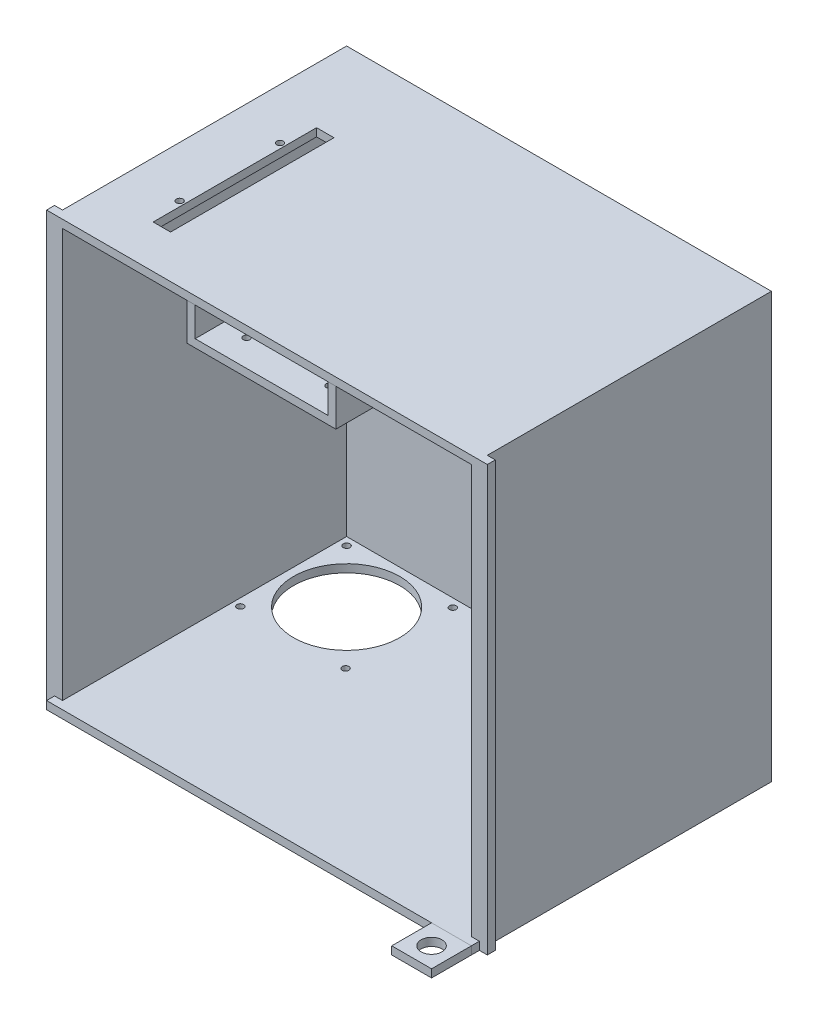
from build123d import *

# Parameters (mm, degrees)
SKETCH1_W              = 203.2
SKETCH1_H              = 203.2
OUTTER_BOX_DEPTH       = 139.7
SHELL1_T               = -3.81
SKETCH4_W              = 71.12
SKETCH4_H              = 63.5
RFID_CARD_HOLDER_DEPTH = 17.78
SHELL2_T               = -3.81
SKETCH6_W              = 203.2
SKETCH6_H              = 3.81
BOSS_EXTRUDE4_DEPTH    = 3.81
SKETCH12_W             = 8.3185
SKETCH12_H             = 78.1685
CUT_EXTRUDE7_DEPTH     = 3.81
SKETCH13_W             = 3.81
SKETCH13_H             = 203.2
BOSS_EXTRUDE5_DEPTH    = 3.81
SKETCH14_W             = 3.81
SKETCH14_H             = 203.2
BOSS_EXTRUDE6_DEPTH    = 3.81
SKETCH16_W             = 19.05
SKETCH16_H             = 3.81
BOSS_EXTRUDE7_DEPTH    = 19.05
SKETCH18_R             = 5
CUT_EXTRUDE9_DEPTH     = 3.81
SKETCH5_R              = 25.4
CUT_EXTRUDE10_DEPTH    = 3.81
SKETCH19_R             = 1.6
CUT_EXTRUDE11_DEPTH    = 3.81
SKETCH20_R             = 1.6
CUT_EXTRUDE12_DEPTH    = 3.81
SKETCH21_W             = 3.81
SKETCH21_H             = 195.58
BOSS_EXTRUDE9_DEPTH    = 12.7
SKETCH23_R             = 1.5875
CUT_EXTRUDE13_DEPTH    = 3.81


with BuildPart() as part:
    # Sketch1 → Outter Box (new body)
    with BuildSketch(Plane.XY):
        Rectangle(SKETCH1_W, SKETCH1_H)
    extrude(amount=OUTTER_BOX_DEPTH)

    # Shell1
    shell1_openings = [part.faces().sort_by_distance(p)[0] for p in [
        (0, 0, 139.7),
    ]]
    offset(amount=SHELL1_T, openings=shell1_openings, kind=Kind.INTERSECTION)

    # Sketch12 → Cut-Extrude7 (cut)
    with BuildSketch(Plane(origin=(0, 101.6, 0), x_dir=(1, 0, 0), z_dir=(0, 1, 0))):
        with Locations((-70.791632516, -80.097769103)):
            Rectangle(SKETCH12_W, SKETCH12_H)
    extrude(amount=-CUT_EXTRUDE7_DEPTH, mode=Mode.SUBTRACT)



with BuildPart() as body_2:
    # Sketch4 → RFID Card holder (new body)
    with BuildSketch(Plane.XZ.offset(-97.79)):
        with Locations((-2.595784724, 107.95)):
            Rectangle(SKETCH4_W, SKETCH4_H)
    extrude(amount=RFID_CARD_HOLDER_DEPTH)

    # Shell2
    shell2_openings = [body_2.faces().sort_by_distance(p)[0] for p in [
        (-2.595784724, 97.79, 107.95),
        (-2.595784724, 88.9, 139.7),
    ]]
    offset(amount=SHELL2_T, openings=shell2_openings, kind=Kind.INTERSECTION)

    # Sketch19 → Cut-Extrude11 (cut)
    with BuildSketch(Plane.XZ.offset(-80.01)):
        with Locations(Location((-22.439534724, 127, 0), (0, 0, 270))):
            Circle(SKETCH19_R)
        with Locations(Location((17.247965276, 127, 0), (0, 0, 270))):
            Circle(SKETCH19_R)
    extrude(amount=-CUT_EXTRUDE11_DEPTH, mode=Mode.SUBTRACT)


with BuildPart() as body_3:
    # Sketch6 → Boss-Extrude4 (new body)
    with BuildSketch(Plane.XY.offset(139.7)):
        with Locations((0, -99.695)):
            Rectangle(SKETCH6_W, SKETCH6_H)
    extrude(amount=BOSS_EXTRUDE4_DEPTH)


with BuildPart() as part_1:
    add(part.part)

    add(body_3.part)  # Boss-Extrude5 merges body 3
    # Sketch13 → Boss-Extrude5 (add)
    with BuildSketch(Plane(origin=(101.6, 0, 0), x_dir=(0, 0, -1), z_dir=(1, 0, 0))):
        with Locations((-137.795, 0)):
            Rectangle(SKETCH13_W, SKETCH13_H)
    extrude(amount=BOSS_EXTRUDE5_DEPTH)

    # Sketch14 → Boss-Extrude6 (add)
    with BuildSketch(Plane.ZY.offset(101.6)):
        with Locations((137.795, 0)):
            Rectangle(SKETCH14_W, SKETCH14_H)
    extrude(amount=BOSS_EXTRUDE6_DEPTH)

    # Sketch5 → Cut-Extrude10 (cut)
    with BuildSketch(Plane.XZ.offset(101.6)):
        with Locations(Location((-68.58, 33.02, 0), (0, 0, 270))):
            Circle(SKETCH5_R)
    extrude(amount=-CUT_EXTRUDE10_DEPTH, mode=Mode.SUBTRACT)

    # Sketch20 → Cut-Extrude12 (cut)
    with BuildSketch(Plane(origin=(0, -97.79, 0), x_dir=(1, 0, 0), z_dir=(0, 1, 0))):
        with Locations(Location((-94.237978912, -58.178415522, 0), (0, 0, 270))):
            Circle(SKETCH20_R)
        with Locations(Location((-43.421584478, -58.677978912, 0), (0, 0, 270))):
            Circle(SKETCH20_R)
        with Locations(Location((-42.922021088, -7.861584478, 0), (0, 0, 270))):
            Circle(SKETCH20_R)
        with Locations(Location((-93.980000617, -7.619999383, 0), (0, 0, 270))):
            Circle(SKETCH20_R)
    extrude(amount=-CUT_EXTRUDE12_DEPTH, mode=Mode.SUBTRACT)

    # Sketch21 → Boss-Extrude9 (add)
    with BuildSketch(Plane.XY.offset(3.81)):
        Rectangle(SKETCH21_W, SKETCH21_H)
    extrude(amount=BOSS_EXTRUDE9_DEPTH)

    # Sketch23 → Cut-Extrude13 (cut)
    with BuildSketch(Plane.XZ.offset(-97.79)):
        with Locations(Location((-77.332132516, 56.094769103, 0), (0, 0, 270))):
            Circle(SKETCH23_R)
        with Locations(Location((-77.332132516, 104.100769103, 0), (0, 0, 270))):
            Circle(SKETCH23_R)
    extrude(amount=-CUT_EXTRUDE13_DEPTH, mode=Mode.SUBTRACT)


with BuildPart() as body_3_2:
    # Sketch16 → Boss-Extrude7 (new body)
    with BuildSketch(Plane.XY.offset(143.51)):
        with Locations((92.075, -99.695)):
            Rectangle(SKETCH16_W, SKETCH16_H)
    extrude(amount=BOSS_EXTRUDE7_DEPTH)

    # Sketch18 → Cut-Extrude9 (cut)
    with BuildSketch(Plane.XZ.offset(101.6)):
        with Locations(Location((92.075, 153.035, 0), (0, 0, 270))):
            Circle(SKETCH18_R)
    extrude(amount=-CUT_EXTRUDE9_DEPTH, mode=Mode.SUBTRACT)


solid = Compound([body_2.part, part_1.part, body_3_2.part])
